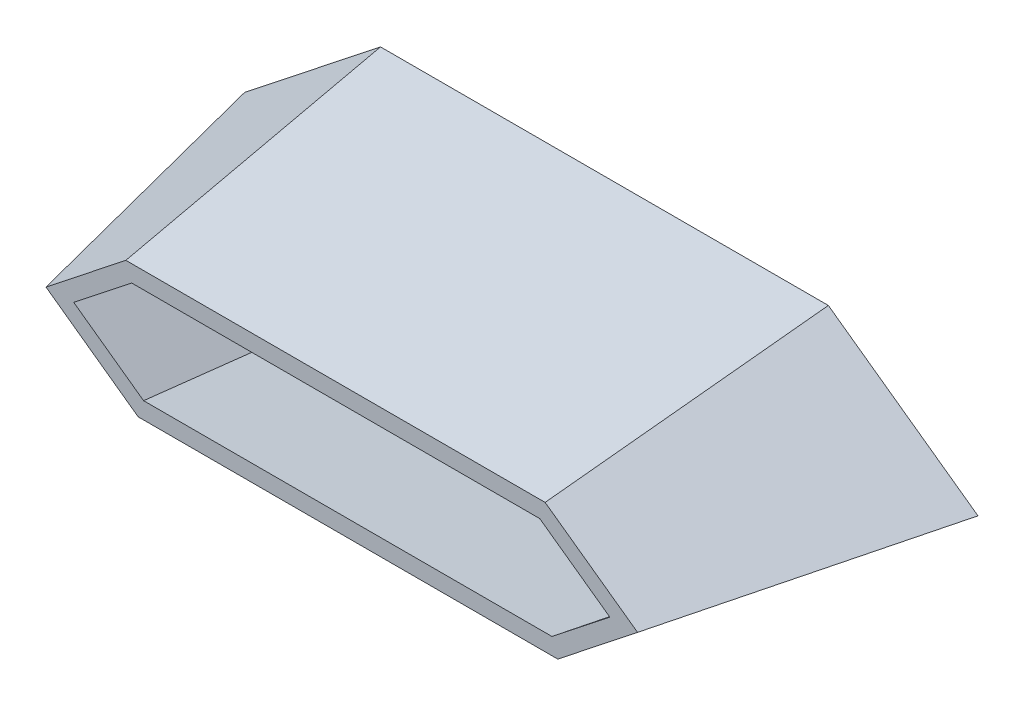
from build123d import *

# Parameters (mm, degrees)
LINEAR_AUSTRAGEN_D_NN1_DEPTH         = 0.6
LINEAR_AUSTRAGEN_D_NN2_DEPTH         = 14
LINEAR_AUSTRAGEN_D_NN2_DRAFT         = -9
SCHNITT_LINEAR_AUSTRAGEN_D_NN1_DEPTH = 16
SCHNITT_LINEAR_AUSTRAGEN_D_NN1_DRAFT = 9


with BuildPart() as part:
    # Skizze1 → Linear-Austragen-Dünn1 (new body)
    with BuildSketch(Plane.XY):
        Polygon((19.865941325, 0), (11.758199437, 5.817213911), (-12.503529969, 5.817213911), (-19.865941325, 0), (-11.77637823, -5.817213911), (-11.17637823, -5.817213911), (-3.47637823, -5.817213911), (4.22362177, -5.817213911), (11.92362177, -5.817213911), (12.503529969, -5.817213911), align=None)
        Polygon((18.204210014, -0.038494533), (11.436566371, 4.817213911), (-12.156143301, 4.817213911), (-18.205362025, 0.037584302), (-11.45415826, -4.817213911), (-11.17637823, -4.817213911), (-3.47637823, -4.817213911), (4.22362177, -4.817213911), (11.92362177, -4.817213911), (12.156143301, -4.817213911), align=None, mode=Mode.SUBTRACT)
    extrude(amount=LINEAR_AUSTRAGEN_D_NN1_DEPTH)


with BuildPart() as linear_austragen_d_nn2_tool:
    # Skizze2 → Linear-Austragen-Dünn2 (with draft: the straight prism first)
    with BuildSketch(Plane.XY.offset(0.6)):
        Polygon((-12.503529969, 5.817213911), (-19.865941325, 0), (-11.77637823, -5.817213911), (12.503529969, -5.817213911), (19.865941325, 0), (11.758199437, 5.817213911), align=None)
        Polygon((-12.156143301, 4.817213911), (-18.205362025, 0.037584302), (-11.45415826, -4.817213911), (12.156143301, -4.817213911), (18.204210014, -0.038494533), (11.436566371, 4.817213911), align=None, mode=Mode.SUBTRACT)
    extrude(amount=LINEAR_AUSTRAGEN_D_NN2_DEPTH)
    # Linear-Austragen-Dünn2: the draft: its side faces are tilted about the plane it starts from
    linear_austragen_d_nn2_sides = [linear_austragen_d_nn2_tool.faces().sort_by_distance(p)[0] for p in [
        (-16.184735647, 2.908606956, 7.6),
        (-15.821159778, -2.908606956, 7.6),
        (0.363575869, -5.817213911, 7.6),
        (16.184735647, -2.908606956, 7.6),
        (15.812070381, 2.908606956, 7.6),
        (-0.372665266, 5.817213911, 7.6),
        (-0.359788465, 4.817213911, 7.6),
        (14.820388192, 2.389359689, 7.6),
        (15.180176658, -2.427854222, 7.6),
        (0.35099252, -4.817213911, 7.6),
        (-14.829760143, -2.389814805, 7.6),
        (-15.180752663, 2.427399106, 7.6),
    ]]
    draft(linear_austragen_d_nn2_sides, Plane.XY.offset(0.6), LINEAR_AUSTRAGEN_D_NN2_DRAFT)


with BuildPart() as part_1:
    add(part.part)

    # Linear-Austragen-Dünn2: add linear_austragen_d_nn2_tool
    add(linear_austragen_d_nn2_tool.part)


with BuildPart() as schnitt_linear_austragen_d_nn1_tool:
    # Skizze3 → Schnitt-Linear-Austragen-Dünn1 (with draft: the straight prism first)
    with BuildSketch(Plane(origin=(0, 0, 0), x_dir=(-1, 0, 0), z_dir=(0, 0, -1))):
        Polygon((-20.862980112, 0.02309672), (-12.71196197, -6.417213911), (11.969710212, -6.417213911), (20.862288905, -0.022550581), (12.71196197, 6.417213911), (-11.951179276, 6.417213911), align=None)
        Polygon((-19.865941325, 0), (-12.503529969, -5.817213911), (11.77637823, -5.817213911), (19.865941325, 0), (12.503529969, 5.817213911), (-11.758199437, 5.817213911), align=None, mode=Mode.SUBTRACT)
    extrude(amount=-SCHNITT_LINEAR_AUSTRAGEN_D_NN1_DEPTH)
    # Schnitt-Linear-Austragen-Dünn1: the draft: its side faces are tilted about the plane it starts from
    schnitt_linear_austragen_d_nn1_sides = [schnitt_linear_austragen_d_nn1_tool.faces().sort_by_distance(p)[0] for p in [
        (16.787471041, -3.197058596, 8),
        (0.371125879, -6.417213911, 8),
        (-16.415999558, -3.219882246, 8),
        (-16.787125437, 3.197331665, 8),
        (-0.380391347, 6.417213911, 8),
        (16.407079694, 3.220155315, 8),
        (15.812070381, 2.908606956, 8),
        (-0.372665266, 5.817213911, 8),
        (-16.184735647, 2.908606956, 8),
        (-15.821159778, -2.908606956, 8),
        (0.363575869, -5.817213911, 8),
        (16.184735647, -2.908606956, 8),
    ]]
    draft(schnitt_linear_austragen_d_nn1_sides, Plane(origin=(0, 0, 0), x_dir=(-1, 0, 0), z_dir=(0, 0, -1)), SCHNITT_LINEAR_AUSTRAGEN_D_NN1_DRAFT)


with BuildPart() as part_2:
    add(part_1.part)

    # Schnitt-Linear-Austragen-Dünn1: cut by schnitt_linear_austragen_d_nn1_tool
    add(schnitt_linear_austragen_d_nn1_tool.part, mode=Mode.SUBTRACT)


solid = part_2.part
